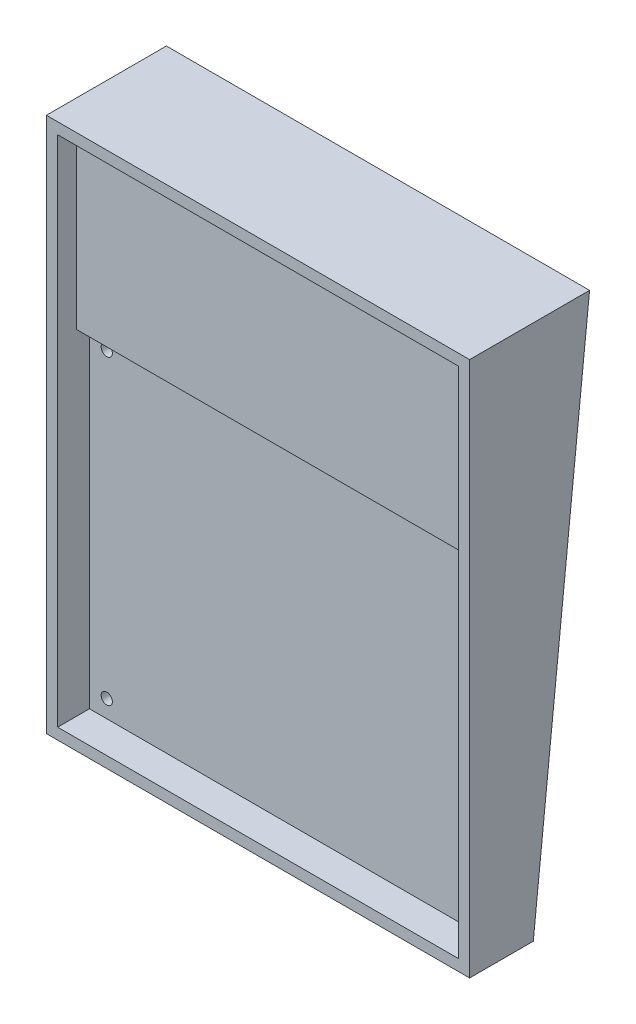
from build123d import *

# Parameters (mm, degrees)
SKETCH_1_W               = 105
SKETCH_1_H               = 135
SKETCH_1_R               = 1.5
EXTRUDE_1_DEPTH          = 1
SKETCH_3_W               = 113
SKETCH_3_H               = 143
SKETCH_3_W_2             = 107
SKETCH_3_H_2             = 137
EXTRUDE_2_DEPTH          = 8.5
SKETCH_3_3_W             = 113
SKETCH_3_3_H             = 143
EXTRUDE_3_DEPTH          = 8.5
CUT_EXTRUDE_1_DEPTH      = 6
CUT_EXTRUDE_1_DEPTH_BACK = 5
SKETCH_1_2_R             = 1.5
SKETCH_4_W               = 107
SKETCH_4_H               = 47.51
EXTRUDE_4_DEPTH          = 3.5
EXTRUDE_5_DEPTH          = 113


with BuildPart() as part:
    # 草圖1 → 填料-伸長1 (new body)
    with BuildSketch(Plane.XY):
        with Locations((52.5, 67.5)):
            Rectangle(SKETCH_1_W, SKETCH_1_H)
        with Locations((3.61, 3.68)):
            Circle(SKETCH_1_R, mode=Mode.SUBTRACT)
        with Locations((101.26, 3.68)):
            Circle(SKETCH_1_R, mode=Mode.SUBTRACT)
        with Locations((3.61, 84.24)):
            Circle(SKETCH_1_R, mode=Mode.SUBTRACT)
        with Locations((101.26, 84.24)):
            Circle(SKETCH_1_R, mode=Mode.SUBTRACT)
    extrude(amount=EXTRUDE_1_DEPTH)



with BuildPart() as body_2:
    # 草圖3 → 填料-伸長2 (new body)
    with BuildSketch(Plane.XY.offset(1)):
        with Locations((52.5, 67.5)):
            Rectangle(SKETCH_3_W, SKETCH_3_H)
        with Locations((52.5, 67.5)):
            Rectangle(SKETCH_3_W_2, SKETCH_3_H_2, mode=Mode.SUBTRACT)
    extrude(amount=EXTRUDE_2_DEPTH)


with BuildPart() as part_1:
    add(part.part)

    add(body_2.part)  # 填料-伸長3 merges body 2
    # 草圖3<3> → 填料-伸長3 (add)
    with BuildSketch(Plane.XY.offset(1)):
        with Locations((52.5, 67.5)):
            Rectangle(SKETCH_3_3_W, SKETCH_3_3_H)
    extrude(amount=-EXTRUDE_3_DEPTH)

    # 草圖1<2> → 除料-伸長1 (cut, two sides: drawn at the far end of the back side and taken through both)
    with BuildSketch(Plane.XY.offset(-CUT_EXTRUDE_1_DEPTH_BACK)):
        with Locations((3.61, 3.68)):
            Circle(SKETCH_1_2_R)
        with Locations((101.26, 3.68)):
            Circle(SKETCH_1_2_R)
        with Locations((3.61, 84.24)):
            Circle(SKETCH_1_2_R)
        with Locations((101.26, 84.24)):
            Circle(SKETCH_1_2_R)
    extrude(amount=CUT_EXTRUDE_1_DEPTH + CUT_EXTRUDE_1_DEPTH_BACK, mode=Mode.SUBTRACT)

    # 草圖4 → 填料-伸長4 (add)
    with BuildSketch(Plane.XY.offset(1)):
        with Locations((52.5, 112.245)):
            Rectangle(SKETCH_4_W, SKETCH_4_H)
    extrude(amount=EXTRUDE_4_DEPTH)

    # 草圖5 → 填料-伸長5 (add)
    with BuildSketch(Plane.ZY.offset(4)):
        Polygon((-7.5, 139), (-22.529905643, 139), (-7.5, -4), align=None)
    extrude(amount=-EXTRUDE_5_DEPTH)


solid = part_1.part
